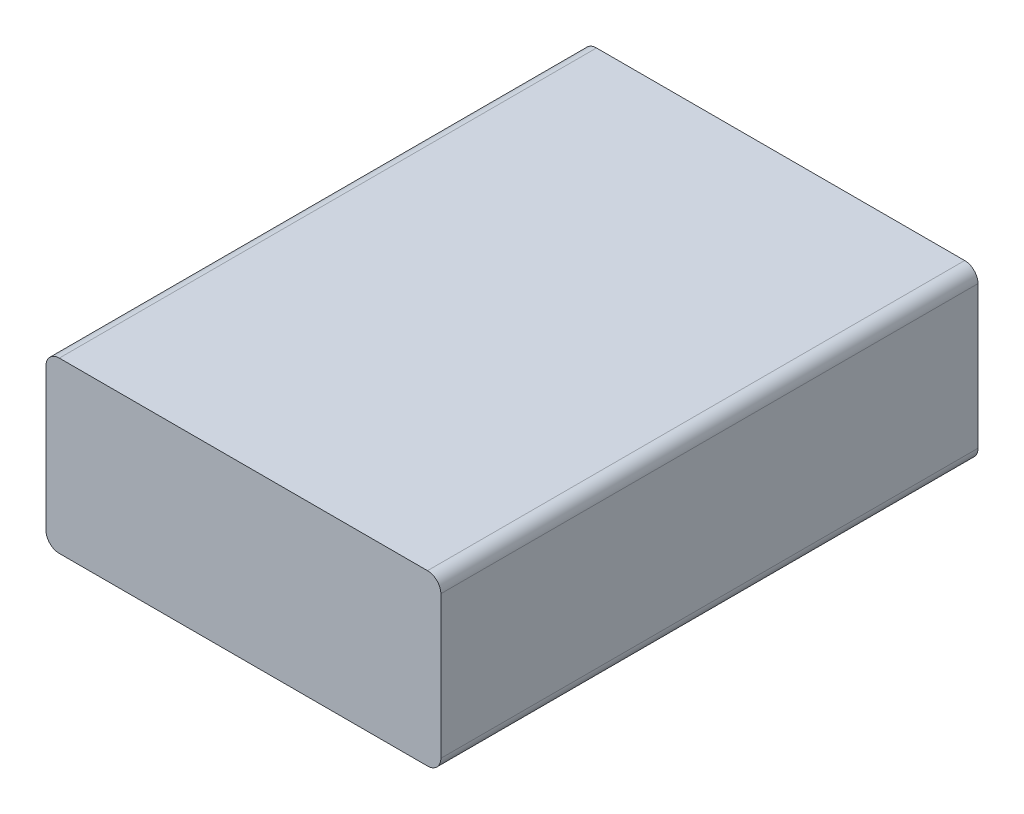
from build123d import *

# Parameters (mm, degrees)
BOSS_EXTRUDE1_DEPTH = 120.95


with BuildPart() as part:
    # Sketch1 → Boss-Extrude1 (new body)
    with BuildSketch(Plane.XY):
        with BuildLine():
            Line((41.45, -19.05), (-41.45, -19.05))
            ThreePointArc((-41.45, -19.05), (-43.571320344, -18.171320344), (-44.45, -16.05))
            Line((-44.45, -16.05), (-44.45, 16.05))
            ThreePointArc((-44.45, 16.05), (-43.571320344, 18.171320344), (-41.45, 19.05))
            Line((-41.45, 19.05), (41.45, 19.05))
            ThreePointArc((41.45, 19.05), (43.571320344, 18.171320344), (44.45, 16.05))
            Line((44.45, 16.05), (44.45, -16.05))
            ThreePointArc((44.45, -16.05), (43.571320344, -18.171320344), (41.45, -19.05))
        make_face()
    extrude(amount=BOSS_EXTRUDE1_DEPTH)


solid = part.part
